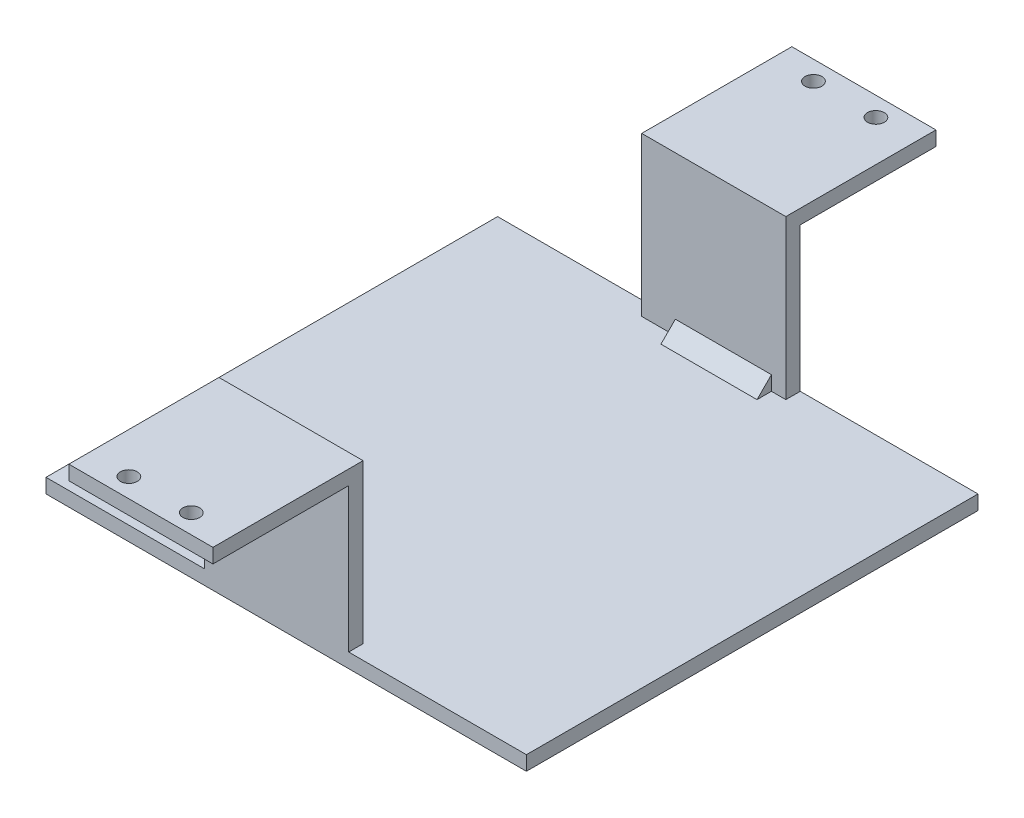
from build123d import *

# Parameters (mm, degrees)
SKETCH1_W           = 100
SKETCH1_H           = 94
BOSS_EXTRUDE1_DEPTH = 3
SKETCH2_W           = 30
SKETCH2_H           = 3
BOSS_EXTRUDE2_DEPTH = 33
BOSS_EXTRUDE3_DEPTH = 10
SKETCH4_W           = 30
SKETCH4_H           = 28.25
SKETCH4_R           = 1.75
BOSS_EXTRUDE4_DEPTH = 3


with BuildPart() as part:
    # Sketch1 → Boss-Extrude1 (new body)
    with BuildSketch(Plane(origin=(0, 0, 0), x_dir=(1, 0, 0), z_dir=(0, 1, 0))):
        Rectangle(SKETCH1_W, SKETCH1_H)
    extrude(amount=-BOSS_EXTRUDE1_DEPTH)

    # Sketch2 → Boss-Extrude2 (add)
    with BuildSketch(Plane(origin=(0, 0, 0), x_dir=(1, 0, 0), z_dir=(0, 1, 0))):
        with Locations((-2, 45.5)):
            Rectangle(SKETCH2_W, SKETCH2_H)
        with Locations((-2, -45.5)):
            Rectangle(SKETCH2_W, SKETCH2_H)
    extrude(amount=BOSS_EXTRUDE2_DEPTH)

    # Sketch3 → Boss-Extrude3 (add, symmetric)
    with BuildSketch(Plane(origin=(0, 0, 0), x_dir=(0, 0, -1), z_dir=(1, 0, 0))):
        Polygon((-44, 3), (-41, 0), (-44, 0), align=None)
        Polygon((44, 3), (41, 0), (44, 0), align=None)
        Polygon((-47, 30), (-50, 30), (-47, 27), align=None)
        Polygon((47, 30), (47, 27), (50, 30), align=None)
    extrude(amount=BOSS_EXTRUDE3_DEPTH, both=True)

    # Sketch4 → Boss-Extrude4 (add)
    # profile 1 of 2: a face of its own
    with BuildSketch(Plane(origin=(0, 33, 0), x_dir=(1, 0, 0), z_dir=(0, 1, 0))):
        with Locations((-2, 61.125)):
            Rectangle(SKETCH4_W, SKETCH4_H)
        with Locations(Location((-8.5, 71.25, 0), (0, 0, 270))):
            Circle(SKETCH4_R, mode=Mode.SUBTRACT)
        with Locations(Location((4.5, 71.25, 0), (0, 0, 270))):
            Circle(SKETCH4_R, mode=Mode.SUBTRACT)
    # profile 2 of 2: a face of its own
    with BuildSketch(Plane(origin=(0, 33, 0), x_dir=(1, 0, 0), z_dir=(0, 1, 0))):
        with Locations((-2, -61.125)):
            Rectangle(SKETCH4_W, SKETCH4_H)
        with Locations(Location((-8.5, -71.25, 0), (0, 0, 270))):
            Circle(SKETCH4_R, mode=Mode.SUBTRACT)
        with Locations(Location((4.5, -71.25, 0), (0, 0, 270))):
            Circle(SKETCH4_R, mode=Mode.SUBTRACT)
    extrude(amount=-BOSS_EXTRUDE4_DEPTH)


solid = part.part
